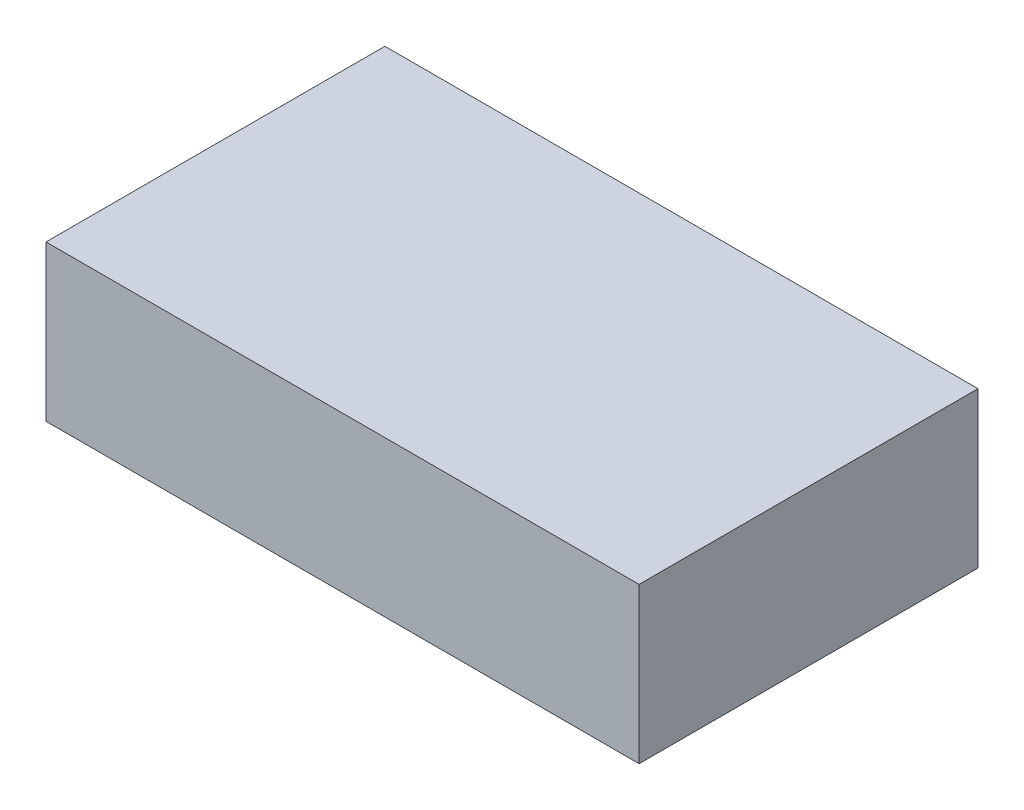
from build123d import *

# Parameters (mm, degrees)
SKETCH1_W           = 42
SKETCH1_H           = 24
BOSS_EXTRUDE1_DEPTH = 11


with BuildPart() as part:
    # Sketch1 → Boss-Extrude1 (new body)
    with BuildSketch(Plane(origin=(0, 0, 0), x_dir=(1, 0, 0), z_dir=(0, 1, 0))):
        with Locations((21, 12)):
            Rectangle(SKETCH1_W, SKETCH1_H)
    extrude(amount=BOSS_EXTRUDE1_DEPTH)


solid = part.part
